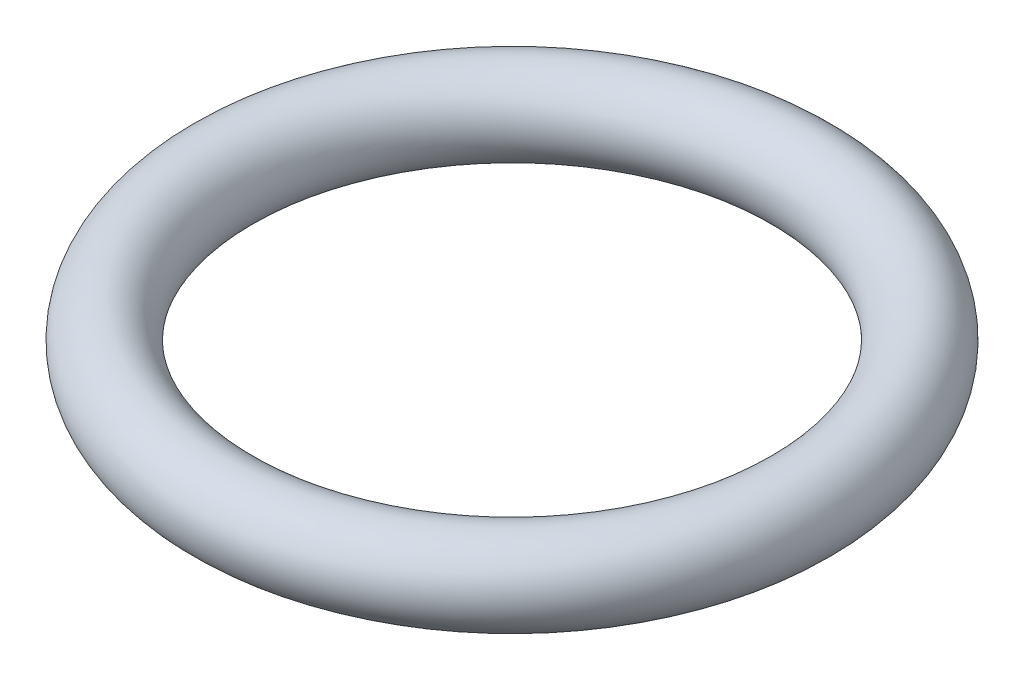
from build123d import *

# Parameters (mm, degrees)
SKETCH_1_R = 2.5


with BuildPart() as part:
    # Эскиз1 → Повернуть1 (revolve)
    with BuildSketch(Plane.XY, mode=Mode.PRIVATE) as revolve_1_sk:
        with Locations((-17.5, 0)):
            Circle(SKETCH_1_R)
    revolve(revolve_1_sk.sketch.rotate(Axis((0, -1000, 0), (0, 1, 0)), 180), axis=Axis((0, -1000, 0), (0, 1, 0)))


solid = part.part
